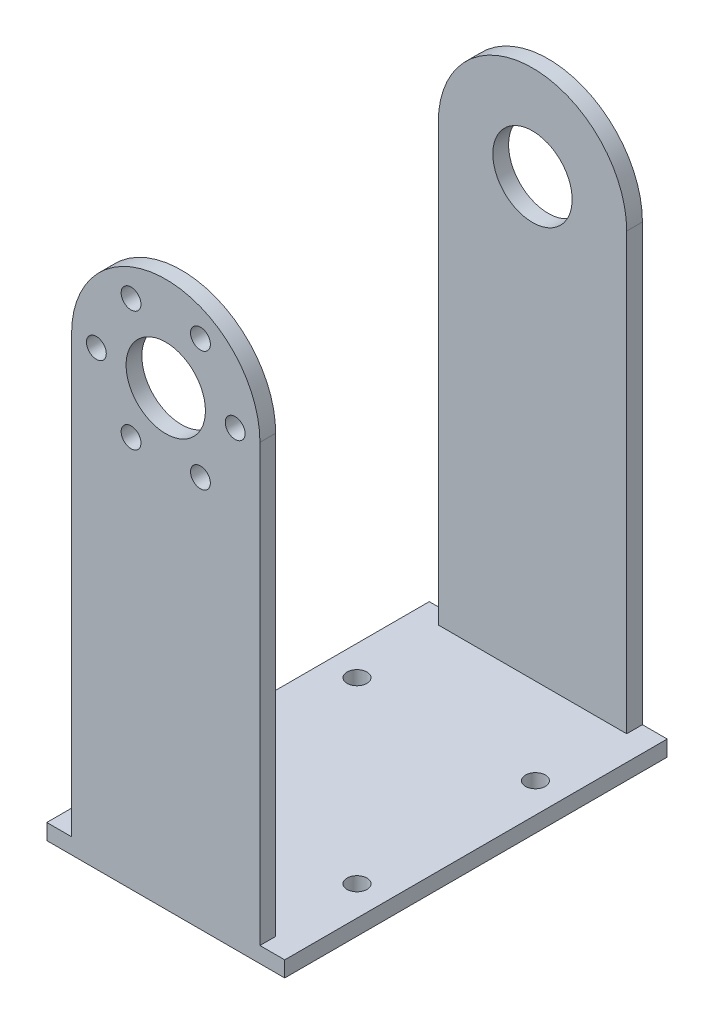
from build123d import *

# Parameters (mm, degrees)
ESQUISSE1_W             = 24
ESQUISSE1_H             = 38.58
BOSS_EXTRU_1_DEPTH      = 1.5875
ESQUISSE5_R             = 1
ESQUISSE5_R_2           = 4
BOSS_EXTRU_8_DEPTH      = 1.5875
ESQUISSE8_R             = 4
BOSS_EXTRU_10_DEPTH     = 1.5875
ESQUISSE11_R            = 1
ENL_V_MAT_EXTRU_3_DEPTH = 1.5875


with BuildPart() as part:
    # Esquisse1 → Boss.-Extru.1 (new body)
    with BuildSketch(Plane(origin=(0, 0, 0), x_dir=(1, 0, 0), z_dir=(0, 1, 0))):
        Rectangle(ESQUISSE1_W, ESQUISSE1_H)
    extrude(amount=BOSS_EXTRU_1_DEPTH)

    # Esquisse5 → Boss.-Extru.8 (add)
    with BuildSketch(Plane.XY.offset(19.29)):
        with BuildLine():
            Line((-9.5, 45.543001341), (-9.5, 1.5875))
            Line((-9.5, 1.5875), (9.5, 1.5875))
            Line((9.5, 1.5875), (9.5, 45.543001341))
            ThreePointArc((9.5, 45.543001341), (0, 55.043001341), (-9.5, 45.543001341))
        make_face()
        with Locations((-3.5, 39.480823515)):
            Circle(ESQUISSE5_R, mode=Mode.SUBTRACT)
        with Locations((-7, 45.543001341)):
            Circle(ESQUISSE5_R, mode=Mode.SUBTRACT)
        with Locations((-3.5, 51.605179168)):
            Circle(ESQUISSE5_R, mode=Mode.SUBTRACT)
        with Locations((3.5, 39.480823515)):
            Circle(ESQUISSE5_R, mode=Mode.SUBTRACT)
        with Locations((0, 45.543001341)):
            Circle(ESQUISSE5_R_2, mode=Mode.SUBTRACT)
        with Locations((3.5, 51.605179168)):
            Circle(ESQUISSE5_R, mode=Mode.SUBTRACT)
        with Locations((7, 45.543001341)):
            Circle(ESQUISSE5_R, mode=Mode.SUBTRACT)
    extrude(amount=-BOSS_EXTRU_8_DEPTH)

    # Esquisse8 → Boss.-Extru.10 (add)
    with BuildSketch(Plane(origin=(0, 0, -19.29), x_dir=(-1, 0, 0), z_dir=(0, 0, -1))):
        with BuildLine():
            Line((-9.5, 45.5), (-9.5, 1.5875))
            Line((-9.5, 1.5875), (9.504737636, 1.5875))
            Line((9.504737636, 1.5875), (9.504737636, 45.5))
            ThreePointArc((9.504737636, 45.5), (0.002368818, 55.002368818), (-9.5, 45.5))
        make_face()
        with Locations((0.002368818, 45.5)):
            Circle(ESQUISSE8_R, mode=Mode.SUBTRACT)
    extrude(amount=-BOSS_EXTRU_10_DEPTH)

    # Esquisse11 → Enlèv. mat.-Extru.3 (cut)
    with BuildSketch(Plane(origin=(0, 1.5875, 0), x_dir=(1, 0, 0), z_dir=(0, 1, 0))):
        with Locations((-9, 9)):
            Circle(ESQUISSE11_R)
        with Locations((9, 9)):
            Circle(ESQUISSE11_R)
        with Locations((9, -9)):
            Circle(ESQUISSE11_R)
        with Locations((-9, -9)):
            Circle(ESQUISSE11_R)
    extrude(amount=-ENL_V_MAT_EXTRU_3_DEPTH, mode=Mode.SUBTRACT)


solid = part.part
